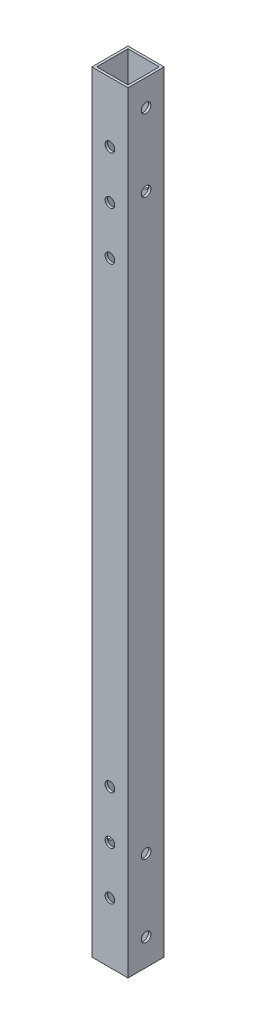
from build123d import *

# Parameters (mm, degrees)
SKETCH_1_W          = 15
SKETCH_1_H          = 15
SKETCH_1_W_2        = 13
SKETCH_1_H_2        = 13
EXTRUDE_1_DEPTH     = 320
SKETCH_3_R          = 2
CUT_EXTRUDE_2_DEPTH = 321.43915179
SKETCH_4_R          = 2
CUT_EXTRUDE_3_DEPTH = 321.43915179


with BuildPart() as part:
    # 草图1 → 凸台-拉伸1 (new body)
    with BuildSketch(Plane(origin=(0, 0, 0), x_dir=(1, 0, 0), z_dir=(0, 1, 0))):
        Rectangle(SKETCH_1_W, SKETCH_1_H)
        Rectangle(SKETCH_1_W_2, SKETCH_1_H_2, mode=Mode.SUBTRACT)
    extrude(amount=EXTRUDE_1_DEPTH)

    # 草图3 → 切除-拉伸2 (cut, through all)
    with BuildSketch(Plane.XY.offset(7.5)):
        with Locations((0, 295)):
            Circle(SKETCH_3_R)
        with Locations((0, 275)):
            Circle(SKETCH_3_R)
        with Locations(Location((0, 45, 0), (0, 0, 180))):
            Circle(SKETCH_3_R)
        with Locations(Location((0, 25, 0), (0, 0, 180))):
            Circle(SKETCH_3_R)
        with Locations((0, 255)):
            Circle(SKETCH_3_R)
        with Locations(Location((0, 65, 0), (0, 0, 180))):
            Circle(SKETCH_3_R)
    extrude(amount=-CUT_EXTRUDE_2_DEPTH, mode=Mode.SUBTRACT)

    # 草图4 → 切除-拉伸3 (cut, through all)
    with BuildSketch(Plane.ZY.offset(7.5)):
        with Locations((0, 11)):
            Circle(SKETCH_4_R)
        with Locations((0, 41)):
            Circle(SKETCH_4_R)
        with Locations(Location((0, 279, 0), (0, 0, 180))):
            Circle(SKETCH_4_R)
        with Locations(Location((0, 309, 0), (0, 0, 180))):
            Circle(SKETCH_4_R)
    extrude(amount=-CUT_EXTRUDE_3_DEPTH, mode=Mode.SUBTRACT)


solid = part.part
